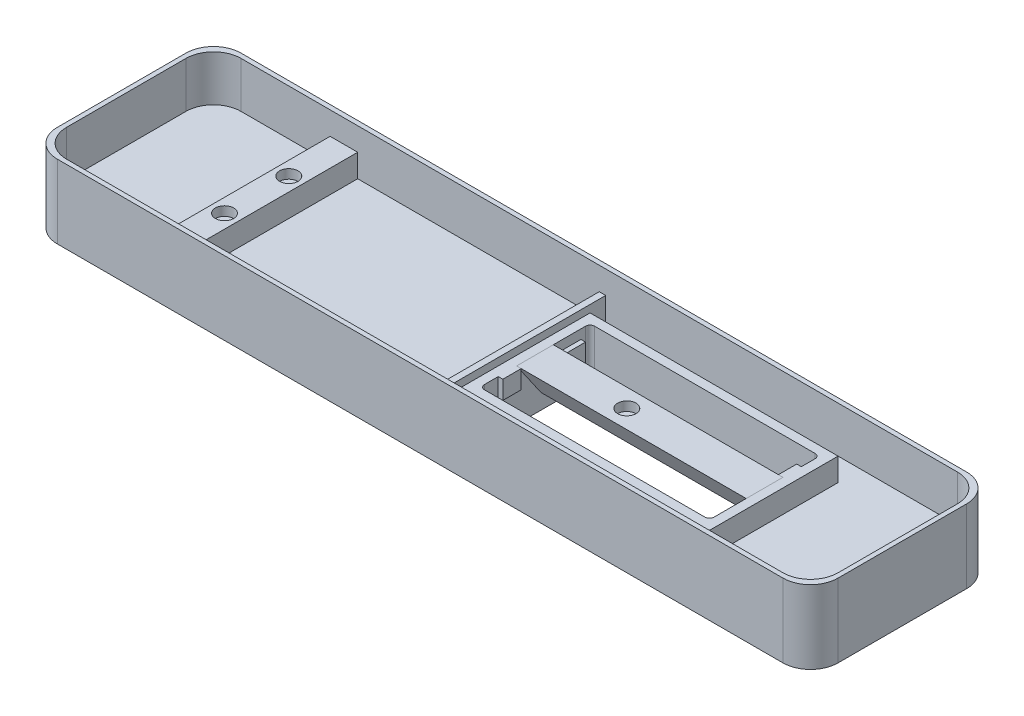
from build123d import *

# Parameters (mm, degrees)
SKETCH1_W               = 215.9
SKETCH1_H               = 50.8
BOSS_EXTRUDE1_DEPTH     = 10.16
SKETCH3_W               = 213.36
SKETCH3_H               = 48.26
CUT_EXTRUDE1_DEPTH      = 12.7
FILLET3_R               = 7.62
SKETCH4_W               = 7.62
SKETCH4_H               = 48.26
SKETCH4_W_2             = 1.778
BOSS_EXTRUDE2_DEPTH     = 6.35
SKETCH5_W               = 68.58
SKETCH5_H               = 35.56
BOSS_EXTRUDE3_DEPTH     = 6.35
CUT_EXTRUDE2_DEPTH      = 112.622813528
CUT_EXTRUDE2_DEPTH_BACK = 112.622813528
SKETCH9_W               = 63.5
SKETCH9_H               = 30.48
SKETCH10_W              = 63.5
SKETCH10_H              = 10.16
BOSS_EXTRUDE4_DEPTH     = 6.35
BOSS_EXTRUDE4_DRAFT     = -28
SKETCH11_W              = 5.08
SKETCH11_H              = 5.08
BOSS_EXTRUDE5_DEPTH     = 1.27
SKETCH13_W              = 5.08
SKETCH13_H              = 5.08
BOSS_EXTRUDE6_DEPTH     = 1.27
SKETCH16_W              = 10.16
SKETCH16_H              = 5.08
CUT_EXTRUDE3_DEPTH      = 1.27
FILLET4_R               = 1.27
SKETCH19_R              = 5.08
CUT_EXTRUDE5_DEPTH      = 0.508
SKETCH21_W              = 3.81
SKETCH21_H              = 0.381
CUT_EXTRUDE7_DEPTH      = 3.937
SKETCH24_R              = 2.54
CUT_EXTRUDE11_DEPTH     = 2.54
SKETCH25_R              = 2.54
CUT_EXTRUDE12_DEPTH     = 2.54


with BuildPart() as part:
    # Sketch1 → Boss-Extrude1 (new, symmetric)
    with BuildSketch(Plane(origin=(0, 0, 0), x_dir=(1, 0, 0), z_dir=(0, 1, 0))):
        Rectangle(SKETCH1_W, SKETCH1_H)
    extrude(amount=BOSS_EXTRUDE1_DEPTH, both=True)

    # Sketch3 → Cut-Extrude1 (cut)
    with BuildSketch(Plane(origin=(0, 10.16, 0), x_dir=(1, 0, 0), z_dir=(0, 1, 0))):
        Rectangle(SKETCH3_W, SKETCH3_H)
    extrude(amount=-CUT_EXTRUDE1_DEPTH, mode=Mode.SUBTRACT)

    # Fillet3
    fillet3_edges = [part.edges().sort_by_distance(p)[0] for p in [
        (106.68, 3.81, 24.13),
        (106.68, 3.81, -24.13),
        (-106.68, 3.81, 24.13),
        (-106.68, 3.81, -24.13),
        (-107.95, 0, 25.4),
        (107.95, 0, -25.4),
        (107.95, 0, 25.4),
        (-107.95, 0, -25.4),
    ]]
    fillet(fillet3_edges, radius=FILLET3_R)

    # Sketch4 → Boss-Extrude2 (add)
    with BuildSketch(Plane(origin=(0, -2.54, 0), x_dir=(1, 0, 0), z_dir=(0, 1, 0))):
        with Locations((-70.612, 0)):
            Rectangle(SKETCH4_W, SKETCH4_H)
        with Locations((0.889, 0)):
            Rectangle(SKETCH4_W_2, SKETCH4_H)
    extrude(amount=BOSS_EXTRUDE2_DEPTH)

    # Sketch5 → Boss-Extrude3 (add)
    with BuildSketch(Plane(origin=(0, -2.54, 0), x_dir=(1, 0, 0), z_dir=(0, 1, 0))):
        with Locations((38.1, 0)):
            Rectangle(SKETCH5_W, SKETCH5_H)
    extrude(amount=BOSS_EXTRUDE3_DEPTH)

    # Sketch9 → Cut-Extrude2 (cut, two sides: drawn at the far end of the back side and taken through both)
    with BuildSketch(Plane(origin=(0, -2.54, 0), x_dir=(1, 0, 0), z_dir=(0, 1, 0)).offset(-CUT_EXTRUDE2_DEPTH_BACK)):
        with Locations((38.1, 0)):
            Rectangle(SKETCH9_W, SKETCH9_H)
    extrude(amount=CUT_EXTRUDE2_DEPTH + CUT_EXTRUDE2_DEPTH_BACK, mode=Mode.SUBTRACT)

    # Sketch11 → Boss-Extrude5 (add)
    with BuildSketch(Plane(origin=(6.35, 0, 0), x_dir=(0, 0, -1), z_dir=(1, 0, 0))):
        with Locations((-7.62, 1.27)):
            Rectangle(SKETCH11_W, SKETCH11_H)
        with Locations((10.16, -1.27)):
            Rectangle(SKETCH11_W, SKETCH11_H)
    extrude(amount=BOSS_EXTRUDE5_DEPTH)

    # Sketch13 → Boss-Extrude6 (add)
    with BuildSketch(Plane.ZY.offset(-69.85)):
        with Locations((-7.62, 1.27)):
            Rectangle(SKETCH13_W, SKETCH13_H)
        with Locations((10.16, -1.27)):
            Rectangle(SKETCH13_W, SKETCH13_H)
    extrude(amount=BOSS_EXTRUDE6_DEPTH)

    # Sketch16 → Cut-Extrude3 (cut)
    with BuildSketch(Plane.ZY.offset(-69.85)):
        with Locations((0, -5.08)):
            Rectangle(SKETCH16_W, SKETCH16_H)
    extrude(amount=-CUT_EXTRUDE3_DEPTH, mode=Mode.SUBTRACT)

    # Fillet4
    fillet4_edges = [part.edges().sort_by_distance(p)[0] for p in [
        (69.85, -3.175, -15.24),
        (69.85, -3.175, 15.24),
        (6.35, -3.175, 15.24),
        (6.35, -3.175, -15.24),
    ]]
    fillet(fillet4_edges, radius=FILLET4_R)

    # Sketch19 → Cut-Extrude5 (cut)
    with BuildSketch(Plane.XZ.offset(10.16)):
        with Locations((71.12, 0)):
            Circle(SKETCH19_R)
    extrude(amount=-CUT_EXTRUDE5_DEPTH, mode=Mode.SUBTRACT)

    # Sketch21 → Cut-Extrude7 (cut)
    with BuildSketch(Plane(origin=(6.35, 0, 0), x_dir=(0, 0, -1), z_dir=(1, 0, 0))):
        with Locations((-10.795, -9.8425)):
            Rectangle(SKETCH21_W, SKETCH21_H)
        with Locations((10.795, -9.8425)):
            Rectangle(SKETCH21_W, SKETCH21_H)
    extrude(amount=-CUT_EXTRUDE7_DEPTH, mode=Mode.SUBTRACT)

    # Sketch24 → Cut-Extrude11 (cut)
    with BuildSketch(Plane(origin=(0, 3.81, 0), x_dir=(1, 0, 0), z_dir=(0, 1, 0))):
        with Locations((-70.612, -8.89)):
            Circle(SKETCH24_R)
        with Locations((-70.612, 8.89)):
            Circle(SKETCH24_R)
    extrude(amount=-CUT_EXTRUDE11_DEPTH, mode=Mode.SUBTRACT)


with BuildPart() as body_2:
    # Sketch10 → Boss-Extrude4 (with draft: the straight prism first)
    with BuildSketch(Plane(origin=(0, 3.81, 0), x_dir=(1, 0, 0), z_dir=(0, 1, 0))):
        with Locations((38.1, 0)):
            Rectangle(SKETCH10_W, SKETCH10_H)
    extrude(amount=-BOSS_EXTRUDE4_DEPTH)
    # Boss-Extrude4: the draft: its side faces are tilted about the plane it starts from
    boss_extrude4_sides = [body_2.faces().sort_by_distance(p)[0] for p in [
        (38.1, 0.635, 5.08),
        (69.85, 0.635, 0),
        (38.1, 0.635, -5.08),
        (6.35, 0.635, 0),
    ]]
    draft(boss_extrude4_sides, Plane(origin=(0, 3.81, 0), x_dir=(1, 0, 0), z_dir=(0, 1, 0)), BOSS_EXTRUDE4_DRAFT)

    # Sketch25 → Cut-Extrude12 (cut)
    with BuildSketch(Plane(origin=(0, 3.81, 0), x_dir=(1, 0, 0), z_dir=(0, 1, 0))):
        with Locations((31.75, 0)):
            Circle(SKETCH25_R)
    extrude(amount=-CUT_EXTRUDE12_DEPTH, mode=Mode.SUBTRACT)


solid = Compound([part.part, body_2.part])
